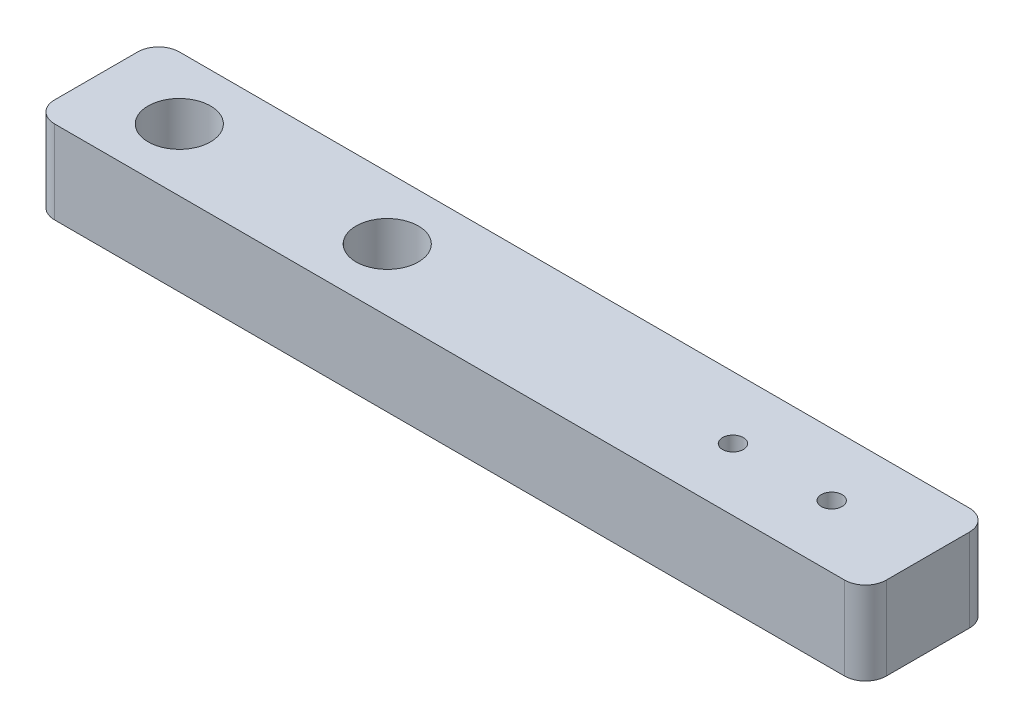
from build123d import *

# Parameters (mm, degrees)
SKETCH1_W           = 80
SKETCH1_H           = 12
BOSS_EXTRUDE1_DEPTH = 8
SKETCH2_R           = 3
SKETCH2_R_2         = 1
CUT_EXTRUDE1_DEPTH  = 42.231056256
FILLET1_R           = 2


with BuildPart() as part:
    # Sketch1 → Boss-Extrude1 (new body)
    with BuildSketch(Plane(origin=(0, 0, 0), x_dir=(1, 0, 0), z_dir=(0, 1, 0))):
        Rectangle(SKETCH1_W, SKETCH1_H)
    extrude(amount=BOSS_EXTRUDE1_DEPTH)

    # Sketch2 → Cut-Extrude1 (cut, through all)
    with BuildSketch(Plane(origin=(0, 8, 0), x_dir=(1, 0, 0), z_dir=(0, 1, 0))):
        with Locations(Location((-32, 0, 0), (0, 0, 270))):
            Circle(SKETCH2_R)
        with Locations(Location((-12, 0, 0), (0, 0, 270))):
            Circle(SKETCH2_R)
        with Locations(Location((21.25, 0, 0), (0, 0, 270))):
            Circle(SKETCH2_R_2)
        with Locations(Location((30.75, 0, 0), (0, 0, 270))):
            Circle(SKETCH2_R_2)
    extrude(amount=-CUT_EXTRUDE1_DEPTH, mode=Mode.SUBTRACT)

    # Fillet1
    fillet1_edges = [part.edges().sort_by_distance(p)[0] for p in [
        (40, 4, 6),
        (-40, 4, 6),
        (-40, 4, -6),
        (40, 4, -6),
    ]]
    fillet(fillet1_edges, radius=FILLET1_R)


solid = part.part
